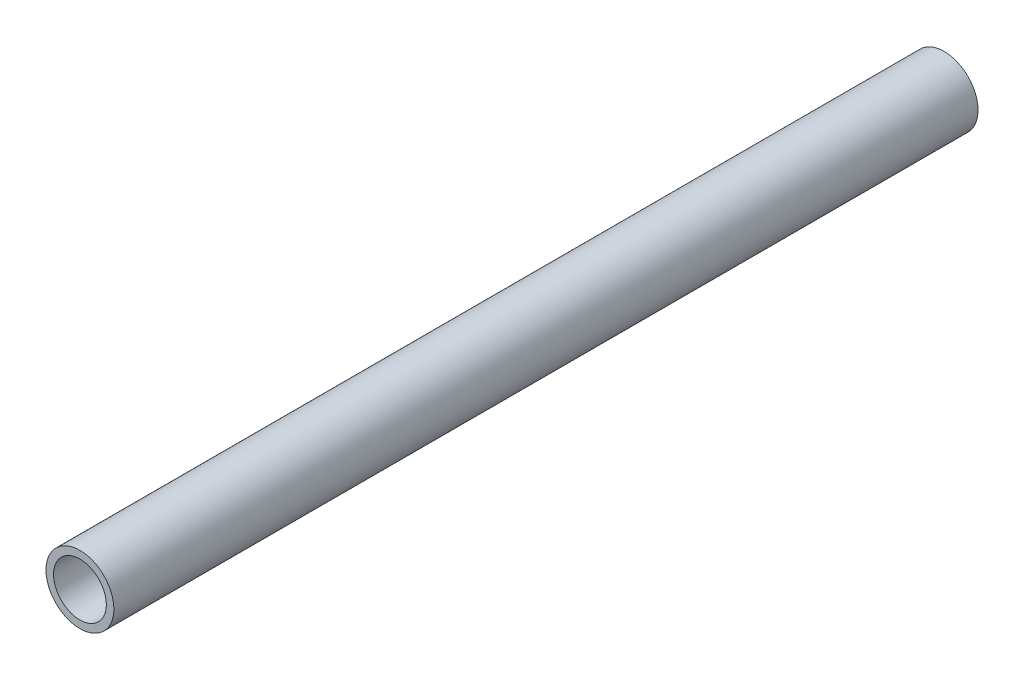
from build123d import *

# Parameters (mm, degrees)
SKETCH1_R           = 9
SKETCH1_R_2         = 7
BOSS_EXTRUDE1_DEPTH = 229.2769


with BuildPart() as part:
    # Sketch1 → Boss-Extrude1 (new body)
    with BuildSketch(Plane.XY):
        with Locations(Location((0, 0, 0), (0, 0, 180))):
            Circle(SKETCH1_R)
        with Locations(Location((0, 0, 0), (0, 0, 180))):
            Circle(SKETCH1_R_2, mode=Mode.SUBTRACT)
    extrude(amount=BOSS_EXTRUDE1_DEPTH)


solid = part.part
